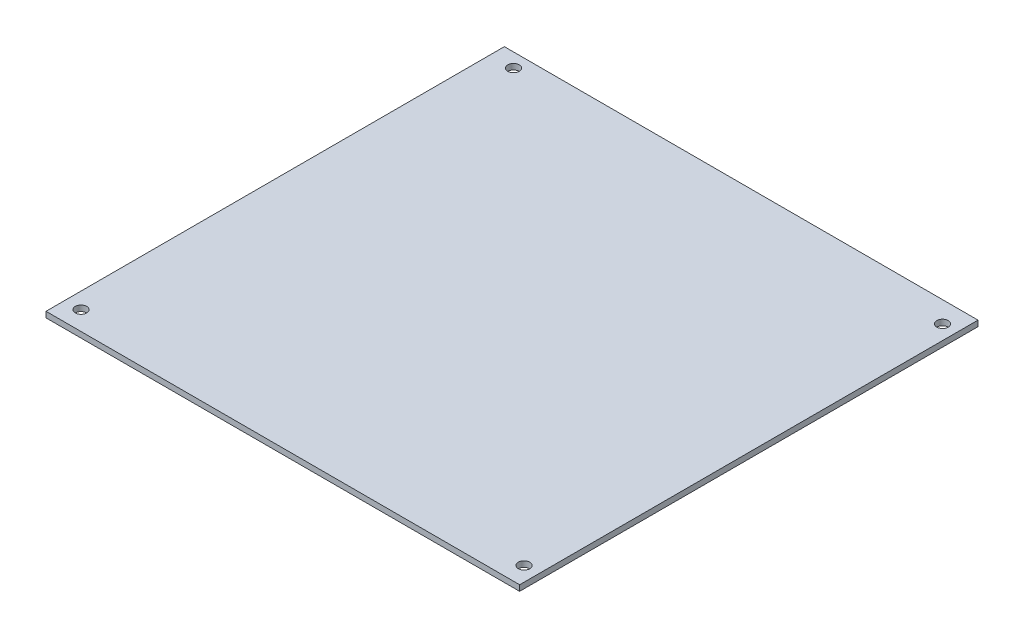
from build123d import *

# Parameters (mm, degrees)
SKETCH1_W           = 124
SKETCH1_H           = 120
BOSS_EXTRUDE1_DEPTH = 1.5
SKETCH2_R           = 1.5
CUT_EXTRUDE7_DEPTH  = 8.5


with BuildPart() as part:
    # Sketch1 → Boss-Extrude1 (new body)
    with BuildSketch(Plane(origin=(0, 0, 0), x_dir=(1, 0, 0), z_dir=(0, 1, 0))):
        Rectangle(SKETCH1_W, SKETCH1_H)
    extrude(amount=BOSS_EXTRUDE1_DEPTH)

    # Sketch2 → Cut-Extrude7 (cut)
    with BuildSketch(Plane(origin=(0, 0, 0), x_dir=(1, 0, 0), z_dir=(0, 1, 0))):
        with Locations(Location((-55.941350506, 56.345551016, 0), (0, 0, 270))):
            Circle(SKETCH2_R)
        with Locations(Location((58.204873359, 54.502113065, 0), (0, 0, 270))):
            Circle(SKETCH2_R)
        with Locations(Location((-57.784788457, -55.052109385, 0), (0, 0, 270))):
            Circle(SKETCH2_R)
        with Locations(Location((58.204873359, -55.052109385, 0), (0, 0, 270))):
            Circle(SKETCH2_R)
    extrude(amount=CUT_EXTRUDE7_DEPTH, mode=Mode.SUBTRACT)


solid = part.part
